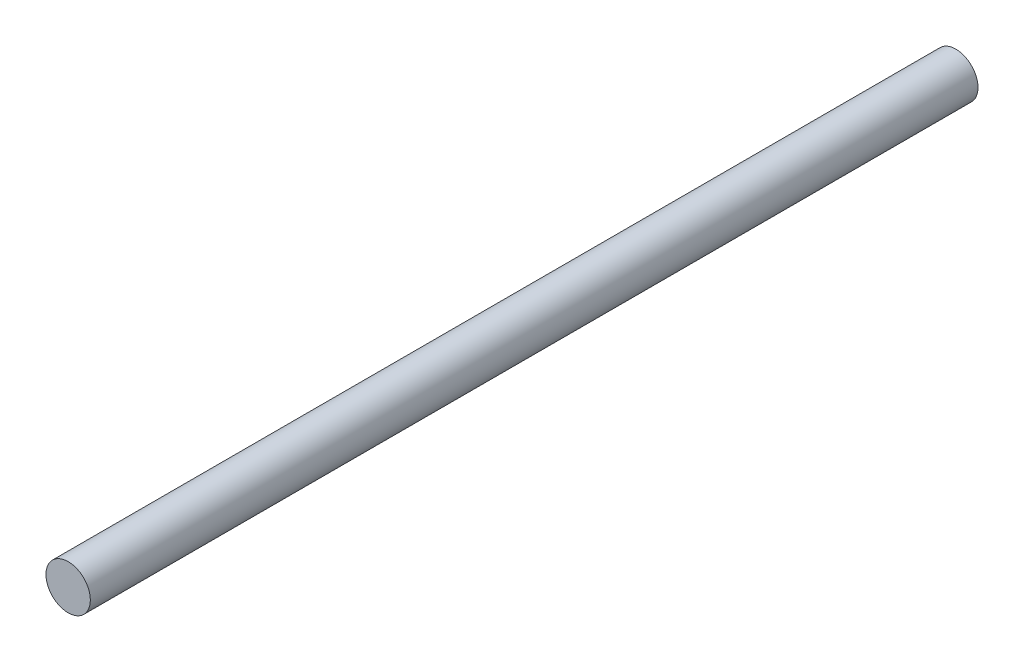
from build123d import *

# Parameters (mm, degrees)
SKETCH3_R           = 40
BOSS_EXTRUDE3_DEPTH = 1600


with BuildPart() as part:
    # Sketch3 → Boss-Extrude3 (new body)
    with BuildSketch(Plane.XY):
        Circle(SKETCH3_R)
    extrude(amount=-BOSS_EXTRUDE3_DEPTH)


solid = part.part
